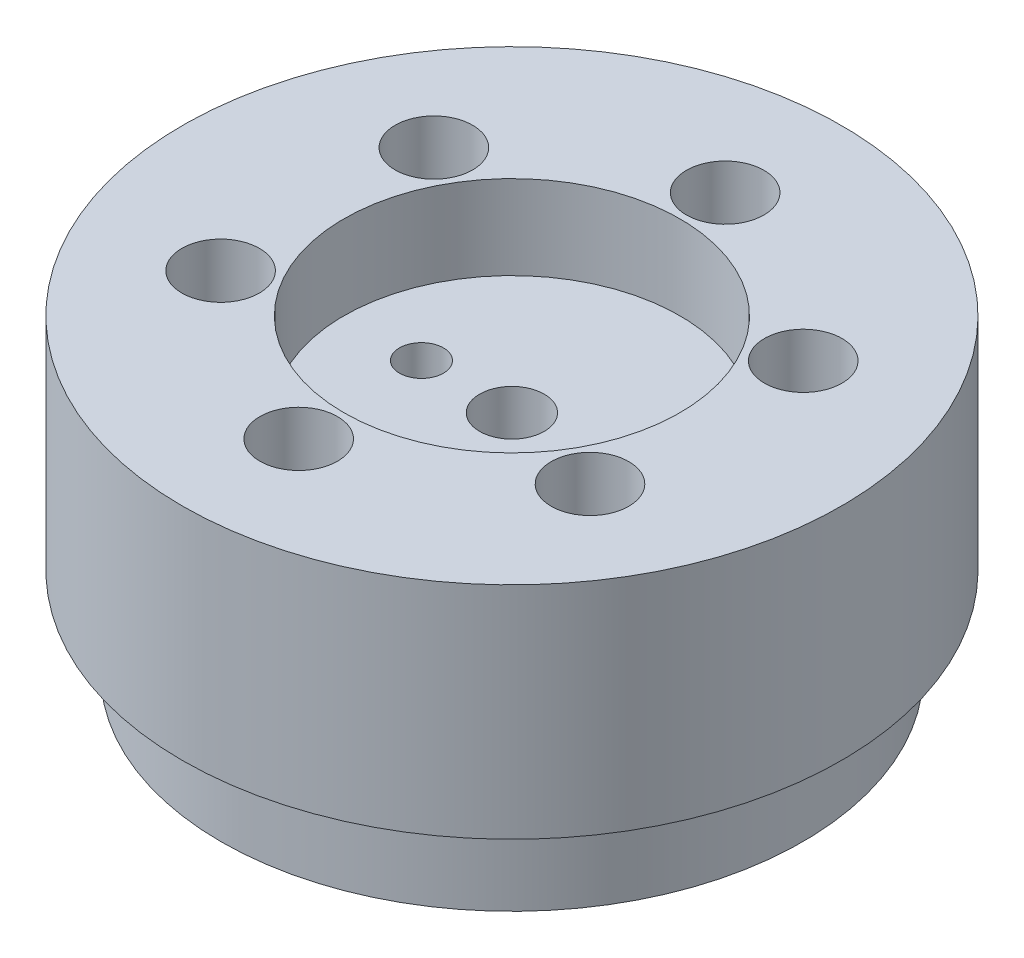
from build123d import *

# Parameters (mm, degrees)
SKETCH2_R            = 22.5
SKETCH2_R_2          = 1.7
SKETCH2_R_3          = 3
BOSS_EXTRUDE1_DEPTH  = 20
SKETCH2_6_R          = 22.5
SKETCH2_6_R_2        = 13
SKETCH2_6_R_3        = 1.7
SKETCH2_6_R_4        = 3
BOSS_EXTRUDE4_DEPTH  = 24
SKETCH2_8_W          = 22.604282846
SKETCH2_8_H          = 12.847038452
SKETCH2_8_R          = 2.5
SKETCH2_8_R_2        = 1.7
CUT_EXTRUDE1_DEPTH   = 20
SKETCH2_9_W          = 22.604282846
SKETCH2_9_H          = 12.847038452
SKETCH2_9_R          = 1.7
SKETCH2_9_R_2        = 2.5
BOSS_EXTRUDE6_DEPTH  = 20
SKETCH2_10_W         = 22.604282846
SKETCH2_10_H         = 12.847038452
SKETCH2_10_R         = 1.7
SKETCH2_10_R_2       = 2.5
CUT_EXTRUDE2_DEPTH   = 15
FILLET3_R            = 3
SKETCH2_11_R         = 3
CUT_EXTRUDE3_DEPTH   = 24
CUT_EXTRUDE4_START   = -2.5
SKETCH3_R            = 13
CUT_EXTRUDE4_DEPTH   = 2.5
SKETCH2_13_R         = 3
SKETCH2_13_R_2       = 1.7
BOSS_EXTRUDE7_DEPTH  = 10
BOSS_EXTRUDE8_START  = -10
SKETCH4_R            = 25.5
SKETCH4_R_2          = 22.5
BOSS_EXTRUDE8_DEPTH  = 14
SKETCH5_R            = 3
SKETCH5_R_2          = 2.5
SKETCH5_R_3          = 1.7
BOSS_EXTRUDE9_DEPTH  = 2
BOSS_EXTRUDE10_START = 2
SKETCH5_8_R          = 3
SKETCH5_8_R_2        = 2.5
BOSS_EXTRUDE10_DEPTH = 4
SKETCH6_R            = 2.5
BOSS_EXTRUDE11_DEPTH = 10
SKETCH6_3_R          = 2.5
SKETCH6_3_R_2        = 1.7
BOSS_EXTRUDE12_DEPTH = 6
BOSS_EXTRUDE13_START = -6.95
SKETCH4_2_R          = 25.5
SKETCH4_2_R_2        = 22.5
BOSS_EXTRUDE13_DEPTH = 3.05


with BuildPart() as part:
    # Sketch2 → Boss-Extrude1 (new body)
    with BuildSketch(Plane(origin=(0, 0, 0), x_dir=(1, 0, 0), z_dir=(0, 1, 0))):
        with Locations(Location((0, 0, 0), (0, 0, 270))):
            Circle(SKETCH2_R)
        with Locations(Location((-7, 0, 0), (0, 0, 270))):
            Circle(SKETCH2_R_2, mode=Mode.SUBTRACT)
        with Locations(Location((7, 0, 0), (0, 0, 270))):
            Circle(SKETCH2_R_2, mode=Mode.SUBTRACT)
        with Locations(Location((0, -16.5, 0), (0, 0, 270))):
            Circle(SKETCH2_R_2, mode=Mode.SUBTRACT)
        with Locations(Location((0, 16.5, 0), (0, 0, 270))):
            Circle(SKETCH2_R_2, mode=Mode.SUBTRACT)
        with Locations(Location((-14.289419162, -8.25, 0), (0, 0, 270))):
            Circle(SKETCH2_R_3, mode=Mode.SUBTRACT)
        with Locations(Location((-14.289419162, 8.25, 0), (0, 0, 270))):
            Circle(SKETCH2_R_3, mode=Mode.SUBTRACT)
        with Locations(Location((14.289419162, 8.25, 0), (0, 0, 270))):
            Circle(SKETCH2_R_3, mode=Mode.SUBTRACT)
        with Locations(Location((14.289419162, -8.25, 0), (0, 0, 270))):
            Circle(SKETCH2_R_3, mode=Mode.SUBTRACT)
    extrude(amount=BOSS_EXTRUDE1_DEPTH)

    # Sketch2<6> → Boss-Extrude4 (add)
    with BuildSketch(Plane(origin=(0, 0, 0), x_dir=(1, 0, 0), z_dir=(0, 1, 0))):
        with Locations(Location((0, 0, 0), (0, 0, 270))):
            Circle(SKETCH2_6_R)
        with Locations(Location((0, 0, 0), (0, 0, 270))):
            Circle(SKETCH2_6_R_2, mode=Mode.SUBTRACT)
        with Locations(Location((0, -16.5, 0), (0, 0, 270))):
            Circle(SKETCH2_6_R_3, mode=Mode.SUBTRACT)
        with Locations(Location((0, 16.5, 0), (0, 0, 270))):
            Circle(SKETCH2_6_R_3, mode=Mode.SUBTRACT)
        with Locations(Location((-14.289419162, -8.25, 0), (0, 0, 270))):
            Circle(SKETCH2_6_R_4, mode=Mode.SUBTRACT)
        with Locations(Location((-14.289419162, 8.25, 0), (0, 0, 270))):
            Circle(SKETCH2_6_R_4, mode=Mode.SUBTRACT)
        with Locations(Location((14.289419162, 8.25, 0), (0, 0, 270))):
            Circle(SKETCH2_6_R_4, mode=Mode.SUBTRACT)
        with Locations(Location((14.289419162, -8.25, 0), (0, 0, 270))):
            Circle(SKETCH2_6_R_4, mode=Mode.SUBTRACT)
    extrude(amount=BOSS_EXTRUDE4_DEPTH)

    # Sketch2<8> → Cut-Extrude1 (cut)
    # profile 1 of 4: a face of its own
    with BuildSketch(Plane(origin=(0, 0, 0), x_dir=(1, 0, 0), z_dir=(0, 1, 0))):
        Rectangle(SKETCH2_8_W, SKETCH2_8_H)
        Circle(SKETCH2_8_R, mode=Mode.SUBTRACT)
    # profile 2 of 4: a face of its own
    with BuildSketch(Plane(origin=(0, 0, 0), x_dir=(1, 0, 0), z_dir=(0, 1, 0))):
        Circle(SKETCH2_8_R)
    # profile 3 of 4: a face of its own
    with BuildSketch(Plane(origin=(0, 0, 0), x_dir=(1, 0, 0), z_dir=(0, 1, 0))):
        with Locations((-7, 0)):
            Circle(SKETCH2_8_R_2)
    # profile 4 of 4: a face of its own
    with BuildSketch(Plane(origin=(0, 0, 0), x_dir=(1, 0, 0), z_dir=(0, 1, 0))):
        with Locations((7, 0)):
            Circle(SKETCH2_8_R_2)
    extrude(amount=CUT_EXTRUDE1_DEPTH, mode=Mode.SUBTRACT)

    # Sketch2<9> → Boss-Extrude6 (add)
    with BuildSketch(Plane(origin=(0, 0, 0), x_dir=(1, 0, 0), z_dir=(0, 1, 0))):
        Rectangle(SKETCH2_9_W, SKETCH2_9_H)
        with Locations(Location((-7, 0, 0), (0, 0, 270))):
            Circle(SKETCH2_9_R, mode=Mode.SUBTRACT)
        with Locations(Location((0, 0, 0), (0, 0, 270))):
            Circle(SKETCH2_9_R_2, mode=Mode.SUBTRACT)
        with Locations(Location((7, 0, 0), (0, 0, 270))):
            Circle(SKETCH2_9_R, mode=Mode.SUBTRACT)
    extrude(amount=BOSS_EXTRUDE6_DEPTH)

    # Sketch2<10> → Cut-Extrude2 (cut)
    with BuildSketch(Plane(origin=(0, 0, 0), x_dir=(1, 0, 0), z_dir=(0, 1, 0))):
        Rectangle(SKETCH2_10_W, SKETCH2_10_H)
        with Locations(Location((7, 0, 0), (0, 0, 270))):
            Circle(SKETCH2_10_R, mode=Mode.SUBTRACT)
        with Locations(Location((-7, 0, 0), (0, 0, 270))):
            Circle(SKETCH2_10_R, mode=Mode.SUBTRACT)
        with Locations(Location((0, 0, 0), (0, 0, 270))):
            Circle(SKETCH2_10_R_2, mode=Mode.SUBTRACT)
    extrude(amount=CUT_EXTRUDE2_DEPTH, mode=Mode.SUBTRACT)

    # Fillet3
    fillet3_edges = [part.edges().sort_by_distance(p)[0] for p in [
        (-11.302141423, 7.5, 6.423519226),
        (11.302141423, 7.5, 6.423519226),
        (11.302141423, 7.5, -6.423519226),
        (-11.302141423, 7.5, -6.423519226),
    ]]
    fillet(fillet3_edges, radius=FILLET3_R)

    # Sketch2<11> → Cut-Extrude3 (cut)
    with BuildSketch(Plane(origin=(0, 0, 0), x_dir=(1, 0, 0), z_dir=(0, 1, 0))):
        with Locations(Location((0, 16.5, 0), (0, 0, 270))):
            Circle(SKETCH2_11_R)
        with Locations(Location((0, -16.5, 0), (0, 0, 270))):
            Circle(SKETCH2_11_R)
    extrude(amount=CUT_EXTRUDE3_DEPTH, mode=Mode.SUBTRACT)

    # Sketch3 → Cut-Extrude4 (cut)
    with BuildSketch(Plane(origin=(0, 20, 0), x_dir=(1, 0, 0), z_dir=(0, 1, 0)).offset(CUT_EXTRUDE4_START)):
        with Locations(Location((0, 0, 0), (0, 0, 270))):
            Circle(SKETCH3_R)
    extrude(amount=CUT_EXTRUDE4_DEPTH, mode=Mode.SUBTRACT)

    # Sketch2<13> → Boss-Extrude7 (add)
    # profile 1 of 6: a face of its own
    with BuildSketch(Plane(origin=(0, 0, 0), x_dir=(1, 0, 0), z_dir=(0, 1, 0))):
        with Locations(Location((-14.289419162, -8.25, 0), (0, 0, 270))):
            Circle(SKETCH2_13_R)
        with Locations(Location((-14.289419162, -8.25, 0), (0, 0, 270))):
            Circle(SKETCH2_13_R_2, mode=Mode.SUBTRACT)
    # profile 2 of 6: a face of its own
    with BuildSketch(Plane(origin=(0, 0, 0), x_dir=(1, 0, 0), z_dir=(0, 1, 0))):
        with Locations(Location((-14.289419162, 8.25, 0), (0, 0, 270))):
            Circle(SKETCH2_13_R)
        with Locations(Location((-14.289419162, 8.25, 0), (0, 0, 270))):
            Circle(SKETCH2_13_R_2, mode=Mode.SUBTRACT)
    # profile 3 of 6: a face of its own
    with BuildSketch(Plane(origin=(0, 0, 0), x_dir=(1, 0, 0), z_dir=(0, 1, 0))):
        with Locations(Location((14.289419162, 8.25, 0), (0, 0, 270))):
            Circle(SKETCH2_13_R)
        with Locations(Location((14.289419162, 8.25, 0), (0, 0, 270))):
            Circle(SKETCH2_13_R_2, mode=Mode.SUBTRACT)
    # profile 4 of 6: a face of its own
    with BuildSketch(Plane(origin=(0, 0, 0), x_dir=(1, 0, 0), z_dir=(0, 1, 0))):
        with Locations(Location((14.289419162, -8.25, 0), (0, 0, 270))):
            Circle(SKETCH2_13_R)
        with Locations(Location((14.289419162, -8.25, 0), (0, 0, 270))):
            Circle(SKETCH2_13_R_2, mode=Mode.SUBTRACT)
    # profile 5 of 6: a face of its own
    with BuildSketch(Plane(origin=(0, 0, 0), x_dir=(1, 0, 0), z_dir=(0, 1, 0))):
        with Locations(Location((0, 16.5, 0), (0, 0, 270))):
            Circle(SKETCH2_13_R)
        with Locations(Location((0, 16.5, 0), (0, 0, 270))):
            Circle(SKETCH2_13_R_2, mode=Mode.SUBTRACT)
    # profile 6 of 6: a face of its own
    with BuildSketch(Plane(origin=(0, 0, 0), x_dir=(1, 0, 0), z_dir=(0, 1, 0))):
        with Locations(Location((0, -16.5, 0), (0, 0, 270))):
            Circle(SKETCH2_13_R)
        with Locations(Location((0, -16.5, 0), (0, 0, 270))):
            Circle(SKETCH2_13_R_2, mode=Mode.SUBTRACT)
    extrude(amount=BOSS_EXTRUDE7_DEPTH)

    # Sketch4 → Boss-Extrude8 (add)
    with BuildSketch(Plane.XZ.offset(BOSS_EXTRUDE8_START)):
        with Locations(Location((0, 0, 0), (0, 0, 90))):
            Circle(SKETCH4_R)
        with Locations(Location((0, 0, 0), (0, 0, 90))):
            Circle(SKETCH4_R_2, mode=Mode.SUBTRACT)
    extrude(amount=-BOSS_EXTRUDE8_DEPTH)

    # Sketch5 → Boss-Extrude9 (add)
    # profile 1 of 12: a face of its own
    with BuildSketch(Plane(origin=(0, 10, 0), x_dir=(1, 0, 0), z_dir=(0, 1, 0))):
        with Locations(Location((-14.289419162, 8.25, 0), (0, 0, 270))):
            Circle(SKETCH5_R)
        with Locations((-14.289419162, 8.25)):
            Circle(SKETCH5_R_2, mode=Mode.SUBTRACT)
    # profile 2 of 12: a face of its own
    with BuildSketch(Plane(origin=(0, 10, 0), x_dir=(1, 0, 0), z_dir=(0, 1, 0))):
        with Locations((-14.289419162, 8.25)):
            Circle(SKETCH5_R_2)
        with Locations(Location((-14.289419162, 8.25, 0), (0, 0, 270))):
            Circle(SKETCH5_R_3, mode=Mode.SUBTRACT)
    # profile 3 of 12: a face of its own
    with BuildSketch(Plane(origin=(0, 10, 0), x_dir=(1, 0, 0), z_dir=(0, 1, 0))):
        with Locations(Location((0, 16.5, 0), (0, 0, 270))):
            Circle(SKETCH5_R)
        with Locations((0, 16.5)):
            Circle(SKETCH5_R_2, mode=Mode.SUBTRACT)
    # profile 4 of 12: a face of its own
    with BuildSketch(Plane(origin=(0, 10, 0), x_dir=(1, 0, 0), z_dir=(0, 1, 0))):
        with Locations((0, 16.5)):
            Circle(SKETCH5_R_2)
        with Locations(Location((0, 16.5, 0), (0, 0, 270))):
            Circle(SKETCH5_R_3, mode=Mode.SUBTRACT)
    # profile 5 of 12: a face of its own
    with BuildSketch(Plane(origin=(0, 10, 0), x_dir=(1, 0, 0), z_dir=(0, 1, 0))):
        with Locations(Location((14.289419162, 8.25, 0), (0, 0, 270))):
            Circle(SKETCH5_R)
        with Locations((14.289419162, 8.25)):
            Circle(SKETCH5_R_2, mode=Mode.SUBTRACT)
    # profile 6 of 12: a face of its own
    with BuildSketch(Plane(origin=(0, 10, 0), x_dir=(1, 0, 0), z_dir=(0, 1, 0))):
        with Locations((14.289419162, 8.25)):
            Circle(SKETCH5_R_2)
        with Locations(Location((14.289419162, 8.25, 0), (0, 0, 270))):
            Circle(SKETCH5_R_3, mode=Mode.SUBTRACT)
    # profile 7 of 12: a face of its own
    with BuildSketch(Plane(origin=(0, 10, 0), x_dir=(1, 0, 0), z_dir=(0, 1, 0))):
        with Locations(Location((14.289419162, -8.25, 0), (0, 0, 270))):
            Circle(SKETCH5_R)
        with Locations((14.289419162, -8.25)):
            Circle(SKETCH5_R_2, mode=Mode.SUBTRACT)
    # profile 8 of 12: a face of its own
    with BuildSketch(Plane(origin=(0, 10, 0), x_dir=(1, 0, 0), z_dir=(0, 1, 0))):
        with Locations((14.289419162, -8.25)):
            Circle(SKETCH5_R_2)
        with Locations(Location((14.289419162, -8.25, 0), (0, 0, 270))):
            Circle(SKETCH5_R_3, mode=Mode.SUBTRACT)
    # profile 9 of 12: a face of its own
    with BuildSketch(Plane(origin=(0, 10, 0), x_dir=(1, 0, 0), z_dir=(0, 1, 0))):
        with Locations(Location((0, -16.5, 0), (0, 0, 270))):
            Circle(SKETCH5_R)
        with Locations((0, -16.5)):
            Circle(SKETCH5_R_2, mode=Mode.SUBTRACT)
    # profile 10 of 12: a face of its own
    with BuildSketch(Plane(origin=(0, 10, 0), x_dir=(1, 0, 0), z_dir=(0, 1, 0))):
        with Locations((0, -16.5)):
            Circle(SKETCH5_R_2)
        with Locations(Location((0, -16.5, 0), (0, 0, 270))):
            Circle(SKETCH5_R_3, mode=Mode.SUBTRACT)
    # profile 11 of 12: a face of its own
    with BuildSketch(Plane(origin=(0, 10, 0), x_dir=(1, 0, 0), z_dir=(0, 1, 0))):
        with Locations(Location((-14.289419162, -8.25, 0), (0, 0, 270))):
            Circle(SKETCH5_R)
        with Locations((-14.289419162, -8.25)):
            Circle(SKETCH5_R_2, mode=Mode.SUBTRACT)
    # profile 12 of 12: a face of its own
    with BuildSketch(Plane(origin=(0, 10, 0), x_dir=(1, 0, 0), z_dir=(0, 1, 0))):
        with Locations((-14.289419162, -8.25)):
            Circle(SKETCH5_R_2)
        with Locations(Location((-14.289419162, -8.25, 0), (0, 0, 270))):
            Circle(SKETCH5_R_3, mode=Mode.SUBTRACT)
    extrude(amount=BOSS_EXTRUDE9_DEPTH)

    # Sketch5<8> → Boss-Extrude10 (add)
    # profile 1 of 6: a face of its own
    with BuildSketch(Plane(origin=(0, 10, 0), x_dir=(1, 0, 0), z_dir=(0, 1, 0)).offset(BOSS_EXTRUDE10_START)):
        with Locations(Location((-14.289419162, 8.25, 0), (0, 0, 270))):
            Circle(SKETCH5_8_R)
        with Locations(Location((-14.289419162, 8.25, 0), (0, 0, 270))):
            Circle(SKETCH5_8_R_2, mode=Mode.SUBTRACT)
    # profile 2 of 6: a face of its own
    with BuildSketch(Plane(origin=(0, 10, 0), x_dir=(1, 0, 0), z_dir=(0, 1, 0)).offset(BOSS_EXTRUDE10_START)):
        with Locations(Location((0, 16.5, 0), (0, 0, 270))):
            Circle(SKETCH5_8_R)
        with Locations(Location((0, 16.5, 0), (0, 0, 270))):
            Circle(SKETCH5_8_R_2, mode=Mode.SUBTRACT)
    # profile 3 of 6: a face of its own
    with BuildSketch(Plane(origin=(0, 10, 0), x_dir=(1, 0, 0), z_dir=(0, 1, 0)).offset(BOSS_EXTRUDE10_START)):
        with Locations(Location((14.289419162, 8.25, 0), (0, 0, 270))):
            Circle(SKETCH5_8_R)
        with Locations(Location((14.289419162, 8.25, 0), (0, 0, 270))):
            Circle(SKETCH5_8_R_2, mode=Mode.SUBTRACT)
    # profile 4 of 6: a face of its own
    with BuildSketch(Plane(origin=(0, 10, 0), x_dir=(1, 0, 0), z_dir=(0, 1, 0)).offset(BOSS_EXTRUDE10_START)):
        with Locations(Location((14.289419162, -8.25, 0), (0, 0, 270))):
            Circle(SKETCH5_8_R)
        with Locations(Location((14.289419162, -8.25, 0), (0, 0, 270))):
            Circle(SKETCH5_8_R_2, mode=Mode.SUBTRACT)
    # profile 5 of 6: a face of its own
    with BuildSketch(Plane(origin=(0, 10, 0), x_dir=(1, 0, 0), z_dir=(0, 1, 0)).offset(BOSS_EXTRUDE10_START)):
        with Locations(Location((0, -16.5, 0), (0, 0, 270))):
            Circle(SKETCH5_8_R)
        with Locations(Location((0, -16.5, 0), (0, 0, 270))):
            Circle(SKETCH5_8_R_2, mode=Mode.SUBTRACT)
    # profile 6 of 6: a face of its own
    with BuildSketch(Plane(origin=(0, 10, 0), x_dir=(1, 0, 0), z_dir=(0, 1, 0)).offset(BOSS_EXTRUDE10_START)):
        with Locations(Location((-14.289419162, -8.25, 0), (0, 0, 270))):
            Circle(SKETCH5_8_R)
        with Locations(Location((-14.289419162, -8.25, 0), (0, 0, 270))):
            Circle(SKETCH5_8_R_2, mode=Mode.SUBTRACT)
    extrude(amount=BOSS_EXTRUDE10_DEPTH)

    # Sketch6 → Boss-Extrude11 (add)
    with BuildSketch(Plane.XZ.offset(-15)):
        with BuildLine():
            ThreePointArc((8.302141423, -6.423519226), (10.423461767, -5.54483957), (11.302141423, -3.423519226))
            Line((11.302141423, -3.423519226), (11.302141423, 3.423519226))
            ThreePointArc((11.302141423, 3.423519226), (10.423461767, 5.54483957), (8.302141423, 6.423519226))
            Line((8.302141423, 6.423519226), (-8.302141423, 6.423519226))
            ThreePointArc((-8.302141423, 6.423519226), (-10.423461767, 5.54483957), (-11.302141423, 3.423519226))
            Line((-11.302141423, 3.423519226), (-11.302141423, -3.423519226))
            ThreePointArc((-11.302141423, -3.423519226), (-10.423461767, -5.54483957), (-8.302141423, -6.423519226))
            Line((-8.302141423, -6.423519226), (8.302141423, -6.423519226))
        make_face()
        with Locations(Location((7, 0, 0), (0, 0, 270))):
            Circle(SKETCH6_R, mode=Mode.SUBTRACT)
        with Locations(Location((-7, 0, 0), (0, 0, 270))):
            Circle(SKETCH6_R, mode=Mode.SUBTRACT)
        with Locations(Location((0, 0, 0), (0, 0, 270))):
            Circle(SKETCH6_R, mode=Mode.SUBTRACT)
    extrude(amount=BOSS_EXTRUDE11_DEPTH)

    # Sketch6<3> → Boss-Extrude12 (add)
    # profile 1 of 2: a face of its own
    with BuildSketch(Plane.XZ.offset(-15)):
        with Locations(Location((-7, 0, 0), (0, 0, 270))):
            Circle(SKETCH6_3_R)
        with Locations(Location((-7, 0, 0), (0, 0, 270))):
            Circle(SKETCH6_3_R_2, mode=Mode.SUBTRACT)
    # profile 2 of 2: a face of its own
    with BuildSketch(Plane.XZ.offset(-15)):
        with Locations(Location((7, 0, 0), (0, 0, 270))):
            Circle(SKETCH6_3_R)
        with Locations(Location((7, 0, 0), (0, 0, 270))):
            Circle(SKETCH6_3_R_2, mode=Mode.SUBTRACT)
    extrude(amount=BOSS_EXTRUDE12_DEPTH)

    # Sketch4<2> → Boss-Extrude13 (add)
    with BuildSketch(Plane.XZ.offset(BOSS_EXTRUDE13_START)):
        with Locations(Location((0, 0, 0), (0, 0, 90))):
            Circle(SKETCH4_2_R)
        with Locations(Location((0, 0, 0), (0, 0, 90))):
            Circle(SKETCH4_2_R_2, mode=Mode.SUBTRACT)
    extrude(amount=-BOSS_EXTRUDE13_DEPTH)


solid = part.part
